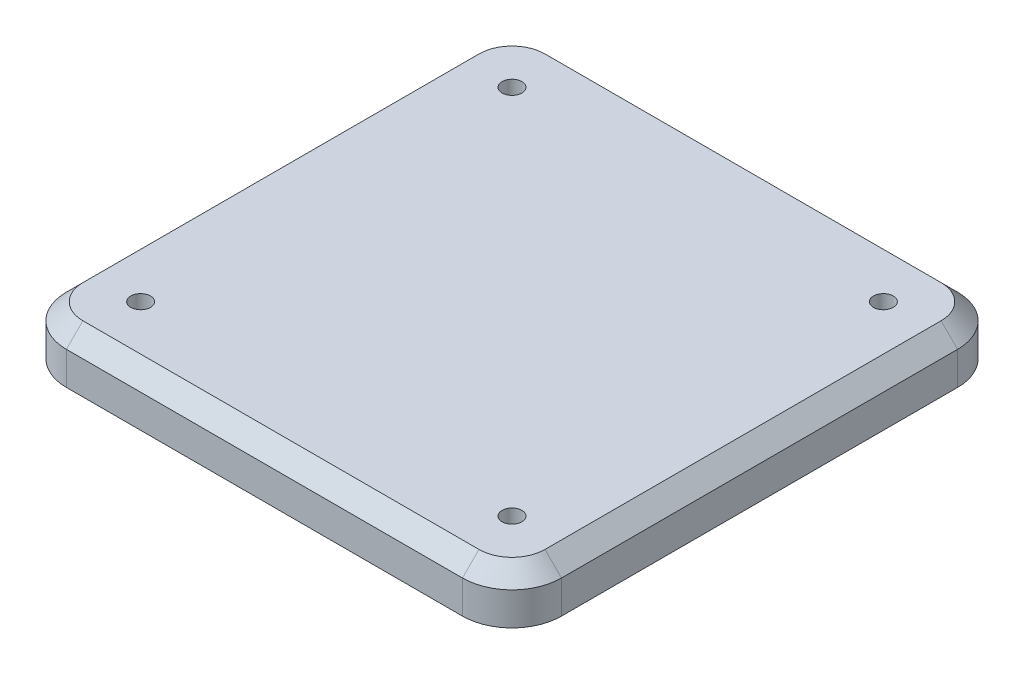
from build123d import *

# Parameters (mm, degrees)
BOSS_EXTRUDE1_DEPTH        = 30
CHAMFER1_SIZE              = 10
F_12_0MM_DOWEL_HOLE3_D     = 12
F_12_0MM_DOWEL_HOLE3_DEPTH = 10
F_12_0MM_DOWEL_HOLE3_TIP   = 3.605163714
F_12_0MM_DOWEL_HOLE4_D     = 12
F_12_0MM_DOWEL_HOLE4_DEPTH = 10
F_12_0MM_DOWEL_HOLE4_TIP   = 3.605163714


with BuildPart() as part:
    # Sketch2 → Boss-Extrude1 (new body)
    with BuildSketch(Plane(origin=(0, 0, 0), x_dir=(1, 0, 0), z_dir=(0, 1, 0))):
        with BuildLine():
            Line((120, 150), (-120, 150))
            ThreePointArc((-120, 150), (-141.213203436, 141.213203436), (-150, 120))
            Line((-150, 120), (-150, -120))
            ThreePointArc((-150, -120), (-141.213203436, -141.213203436), (-120, -150))
            Line((-120, -150), (120, -150))
            ThreePointArc((120, -150), (141.213203436, -141.213203436), (150, -120))
            Line((150, -120), (150, 120))
            ThreePointArc((150, 120), (141.213203436, 141.213203436), (120, 150))
        make_face()
    extrude(amount=BOSS_EXTRUDE1_DEPTH)

    # Chamfer1
    chamfer1_edges = [part.edges().sort_by_distance(p)[0] for p in [
        (-141.213203436, 30, 141.213203436),
        (0, 30, 150),
        (141.213203436, 30, 141.213203436),
        (150, 30, 0),
        (141.213203436, 30, -141.213203436),
        (0, 30, -150),
        (-141.213203436, 30, -141.213203436),
        (-150, 30, 0),
    ]]
    chamfer(chamfer1_edges, length=CHAMFER1_SIZE)

    # Ø12.0mm Dowel Hole3
    with Locations(Plane(origin=(-112.5, 30, -112.5), x_dir=(0, 0, 1), z_dir=(0, 1, 0))):
        with Locations((0, 0), (0, 225), (225, 225), (225, 0)):
            Hole(F_12_0MM_DOWEL_HOLE3_D / 2, depth=F_12_0MM_DOWEL_HOLE3_DEPTH)
            with Locations((0, 0, -(F_12_0MM_DOWEL_HOLE3_DEPTH + F_12_0MM_DOWEL_HOLE3_TIP / 2))):  # 118° drill point
                Cone(0, F_12_0MM_DOWEL_HOLE3_D / 2, F_12_0MM_DOWEL_HOLE3_TIP, mode=Mode.SUBTRACT)

    # Ø12.0mm Dowel Hole4
    with Locations(Plane(origin=(-125, 0, 125), x_dir=(0, 0, -1), z_dir=(0, -1, 0))):
        with Locations((0, 0), (0, 250), (250, 250), (250, 0)):
            Hole(F_12_0MM_DOWEL_HOLE4_D / 2, depth=F_12_0MM_DOWEL_HOLE4_DEPTH)
            with Locations((0, 0, -(F_12_0MM_DOWEL_HOLE4_DEPTH + F_12_0MM_DOWEL_HOLE4_TIP / 2))):  # 118° drill point
                Cone(0, F_12_0MM_DOWEL_HOLE4_D / 2, F_12_0MM_DOWEL_HOLE4_TIP, mode=Mode.SUBTRACT)


solid = part.part
